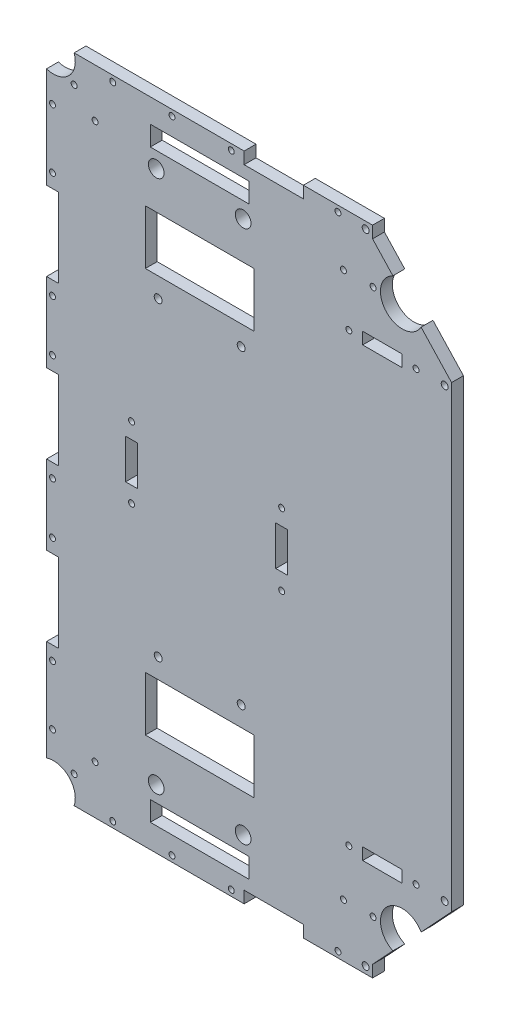
from build123d import *

# Parameters (mm, degrees)
ESQUISSE1_W                     = 205
ESQUISSE1_H                     = 330
BOSS_EXTRU_1_DEPTH              = 6
ESQUISSE2_R                     = 11
ESQUISSE2_R_2                   = 1.5
ESQUISSE2_W                     = 20
ESQUISSE2_H                     = 6
ROULEMENT_ENCOCHE_INTERNE_DEPTH = 389.536999525
ESQUISSE3_W                     = 30
ESQUISSE3_H                     = 6
ESQUISSE3_W_2                   = 6
ESQUISSE3_H_2                   = 40
ENL_V_MAT_ENCOCHE_DEPTH         = 389.536999525
ESQUISSE6_R                     = 2
ESQUISSE6_R_2                   = 3.975
ESQUISSE6_W                     = 55
ESQUISSE6_H                     = 27.5
ESQUISSE6_W_2                   = 50
ESQUISSE6_H_2                   = 10
ESQUISSE6_W_3                   = 6
ESQUISSE6_H_3                   = 20
BLOC_MOTEUR_DEPTH               = 389.536999525
ESQUISSE7_R                     = 1.5
ESQUISSE7_R_2                   = 1.505
ESQUISSE7_R_3                   = 1.75
ENL_V_MAT_EXTRU_4_DEPTH         = 389.536999525
ESQUISSE8_R                     = 2.995
ESQUISSE8_R_2                   = 4
ESQUISSE8_R_3                   = 3.495
ESQUISSE8_R_4                   = 3
ENL_V_MAT_EXTRU_7_DEPTH         = 3


with BuildPart() as part:
    # Esquisse1 → Boss.-Extru.1 (new body)
    with BuildSketch(Plane.XY):
        with Locations((-102.5, 165)):
            Rectangle(ESQUISSE1_W, ESQUISSE1_H)
    extrude(amount=BOSS_EXTRU_1_DEPTH)

    # Esquisse2 → roulement + encoche interne (cut, through all)
    with BuildSketch(Plane.XY.offset(6)):
        with Locations((-201.464466094, 3.535533906)):
            Circle(ESQUISSE2_R)
        with Locations((-39.73, 303)):
            Circle(ESQUISSE2_R_2)
        with Locations((-25, 303)):
            Circle(ESQUISSE2_R)
        with Locations((-191.048783207, 13.951216793)):
            Circle(ESQUISSE2_R_2)
        with Locations((-180.442181489, 24.557818511)):
            Circle(ESQUISSE2_R_2)
        with Locations((-25, 27)):
            Circle(ESQUISSE2_R)
        with Locations((-201.464466094, 326.464466094)):
            Circle(ESQUISSE2_R)
        with Locations(Location((-191.048783207, 316.048783207, 0), (0, 0, 180))):
            Circle(ESQUISSE2_R_2)
        with Locations(Location((-180.442181489, 305.442181489, 0), (0, 0, 180))):
            Circle(ESQUISSE2_R_2)
        with Locations((-54.73, 303)):
            Circle(ESQUISSE2_R_2)
        with Locations((-39.73, 27)):
            Circle(ESQUISSE2_R_2)
        with Locations((-54.73, 27)):
            Circle(ESQUISSE2_R_2)
        with Locations((-35, 278)):
            Rectangle(ESQUISSE2_W, ESQUISSE2_H)
        with Locations((-35, 52)):
            Rectangle(ESQUISSE2_W, ESQUISSE2_H)
    extrude(amount=-ROULEMENT_ENCOCHE_INTERNE_DEPTH, mode=Mode.SUBTRACT)

    # Esquisse3 → Enlèv. mat encoche (cut, through all)
    with BuildSketch(Plane.XY.offset(6)):
        Polygon((0, 330), (-40, 330), (-40, 324), (0, 281), align=None)
        Polygon((-40, 0), (-40, 6), (0, 49), (0, 0), align=None)
        with Locations((-90, 3)):
            Rectangle(ESQUISSE3_W, ESQUISSE3_H)
        with Locations((-202, 165)):
            Rectangle(ESQUISSE3_W_2, ESQUISSE3_H_2)
        with Locations((-202, 85)):
            Rectangle(ESQUISSE3_W_2, ESQUISSE3_H_2)
        with Locations((-90, 327)):
            Rectangle(ESQUISSE3_W, ESQUISSE3_H)
        with Locations((-202, 245)):
            Rectangle(ESQUISSE3_W_2, ESQUISSE3_H_2)
    extrude(amount=-ENL_V_MAT_ENCOCHE_DEPTH, mode=Mode.SUBTRACT)

    # Esquisse6 → bloc moteur (cut, through all)
    with BuildSketch(Plane.XY.offset(6)):
        with Locations((-148.5, 243.5)):
            Circle(ESQUISSE6_R)
        with Locations(Location((-106.5, 243.5, 0), (0, 0, 180))):
            Circle(ESQUISSE6_R)
        with Locations((-149.5, 300)):
            Circle(ESQUISSE6_R_2)
        with Locations(Location((-105.5, 300, 0), (0, 0, 180))):
            Circle(ESQUISSE6_R_2)
        with Locations((-105.5, 30)):
            Circle(ESQUISSE6_R_2)
        with Locations(Location((-149.5, 30, 0), (0, 0, 180))):
            Circle(ESQUISSE6_R_2)
        with Locations((-106.5, 86.5)):
            Circle(ESQUISSE6_R)
        with Locations(Location((-148.5, 86.5, 0), (0, 0, 180))):
            Circle(ESQUISSE6_R)
        with Locations((-127.5, 267.25)):
            Rectangle(ESQUISSE6_W, ESQUISSE6_H)
        with Locations((-127.5, 313)):
            Rectangle(ESQUISSE6_W_2, ESQUISSE6_H_2)
        with Locations((-127.5, 17)):
            Rectangle(ESQUISSE6_W_2, ESQUISSE6_H_2)
        with Locations((-127.5, 62.75)):
            Rectangle(ESQUISSE6_W, ESQUISSE6_H)
        with Locations((-162, 165)):
            Rectangle(ESQUISSE6_W_3, ESQUISSE6_H_3)
        with Locations((-86, 165)):
            Rectangle(ESQUISSE6_W_3, ESQUISSE6_H_3)
    extrude(amount=-BLOC_MOTEUR_DEPTH, mode=Mode.SUBTRACT)

    # Esquisse7 → Enlèv. mat.-Extru.4 (cut, through all)
    with BuildSketch(Plane.XY.offset(6)):
        with Locations((-57.5, 3)):
            Circle(ESQUISSE7_R)
        with Locations((-171.504166956, 3)):
            Circle(ESQUISSE7_R)
        with Locations((-111.504166956, 3)):
            Circle(ESQUISSE7_R)
        with Locations((-202, 58)):
            Circle(ESQUISSE7_R)
        with Locations((-202, 272)):
            Circle(ESQUISSE7_R)
        with Locations((-57.5, 327)):
            Circle(ESQUISSE7_R)
        with Locations((-171.5, 327)):
            Circle(ESQUISSE7_R)
        with Locations((-18, 52)):
            Circle(ESQUISSE7_R)
        with Locations((-52, 52)):
            Circle(ESQUISSE7_R)
        with Locations((-18, 278)):
            Circle(ESQUISSE7_R)
        with Locations((-52, 278)):
            Circle(ESQUISSE7_R)
        with Locations((-202, 112)):
            Circle(ESQUISSE7_R)
        with Locations((-202, 138)):
            Circle(ESQUISSE7_R)
        with Locations((-162, 147)):
            Circle(ESQUISSE7_R_2)
        with Locations((-141.5, 327)):
            Circle(ESQUISSE7_R)
        with Locations((-202, 192)):
            Circle(ESQUISSE7_R)
        with Locations((-202, 218)):
            Circle(ESQUISSE7_R)
        with Locations((-162, 183)):
            Circle(ESQUISSE7_R_2)
        with Locations((-141.504166956, 3)):
            Circle(ESQUISSE7_R)
        with Locations((-111.5, 327)):
            Circle(ESQUISSE7_R)
        with Locations((-202, 302)):
            Circle(ESQUISSE7_R)
        with Locations((-202, 28)):
            Circle(ESQUISSE7_R)
        with Locations((-43.5, 326.5)):
            Circle(ESQUISSE7_R_3)
        with Locations((-3.5, 278)):
            Circle(ESQUISSE7_R_3)
        with Locations((-3.5, 52)):
            Circle(ESQUISSE7_R_3)
        with Locations((-43.5, 3.5)):
            Circle(ESQUISSE7_R_3)
        with Locations((-86, 146.730015328)):
            Circle(ESQUISSE7_R)
        with Locations((-86, 183)):
            Circle(ESQUISSE7_R_2)
    extrude(amount=-ENL_V_MAT_EXTRU_4_DEPTH, mode=Mode.SUBTRACT)

    # Esquisse8 → Enlèv. mat.-Extru.7 (cut)
    with BuildSketch(Plane(origin=(0, 0, 0), x_dir=(-1, 0, 0), z_dir=(0, 0, -1))):
        with Locations((171.5, 327)):
            Circle(ESQUISSE8_R)
        with Locations((202, 302)):
            Circle(ESQUISSE8_R)
        with Locations((202, 272)):
            Circle(ESQUISSE8_R)
        with Locations((202, 218)):
            Circle(ESQUISSE8_R)
        with Locations((202, 192)):
            Circle(ESQUISSE8_R)
        with Locations((141.5, 327)):
            Circle(ESQUISSE8_R)
        with Locations((111.5, 327)):
            Circle(ESQUISSE8_R)
        with Locations((57.5, 327)):
            Circle(ESQUISSE8_R)
        with Locations((52, 278)):
            Circle(ESQUISSE8_R)
        with Locations((18, 278)):
            Circle(ESQUISSE8_R)
        with Locations((148.5, 243.5)):
            Circle(ESQUISSE8_R_2)
        with Locations((106.5, 243.5)):
            Circle(ESQUISSE8_R_2)
        with Locations(Location((106.5, 86.5, 0), (0, 0, 180))):
            Circle(ESQUISSE8_R_2)
        with Locations(Location((148.5, 86.5, 0), (0, 0, 180))):
            Circle(ESQUISSE8_R_2)
        with Locations((3.5, 278)):
            Circle(ESQUISSE8_R_3)
        with Locations(Location((52, 52, 0), (0, 0, 180))):
            Circle(ESQUISSE8_R)
        with Locations(Location((18, 52, 0), (0, 0, 180))):
            Circle(ESQUISSE8_R)
        with Locations(Location((57.5, 3, 0), (0, 0, 180))):
            Circle(ESQUISSE8_R)
        with Locations(Location((111.5, 3, 0), (0, 0, 180))):
            Circle(ESQUISSE8_R)
        with Locations(Location((141.5, 3, 0), (0, 0, 180))):
            Circle(ESQUISSE8_R)
        with Locations(Location((171.5, 3, 0), (0, 0, 180))):
            Circle(ESQUISSE8_R)
        with Locations(Location((202, 28, 0), (0, 0, 180))):
            Circle(ESQUISSE8_R)
        with Locations(Location((202, 58, 0), (0, 0, 180))):
            Circle(ESQUISSE8_R)
        with Locations(Location((202, 112, 0), (0, 0, 180))):
            Circle(ESQUISSE8_R)
        with Locations(Location((202, 138, 0), (0, 0, 180))):
            Circle(ESQUISSE8_R)
        with Locations((54.73, 303)):
            Circle(ESQUISSE8_R_4)
        with Locations((39.73, 303)):
            Circle(ESQUISSE8_R_4)
        with Locations(Location((39.73, 27, 0), (0, 0, 180))):
            Circle(ESQUISSE8_R_4)
        with Locations(Location((54.73, 27, 0), (0, 0, 180))):
            Circle(ESQUISSE8_R_4)
        with Locations((180.442181489, 305.442181489)):
            Circle(ESQUISSE8_R_4)
        with Locations((191.048783207, 316.048783207)):
            Circle(ESQUISSE8_R_4)
        with Locations(Location((191.048783207, 13.951216793, 0), (0, 0, 180))):
            Circle(ESQUISSE8_R_4)
        with Locations(Location((180.442181489, 24.557818511, 0), (0, 0, 180))):
            Circle(ESQUISSE8_R_4)
        with Locations((43.5, 326.5)):
            Circle(ESQUISSE8_R_3)
        with Locations((43.5, 3.5)):
            Circle(ESQUISSE8_R_3)
        with Locations((3.5, 52)):
            Circle(ESQUISSE8_R_3)
    extrude(amount=-ENL_V_MAT_EXTRU_7_DEPTH, mode=Mode.SUBTRACT)


solid = part.part
